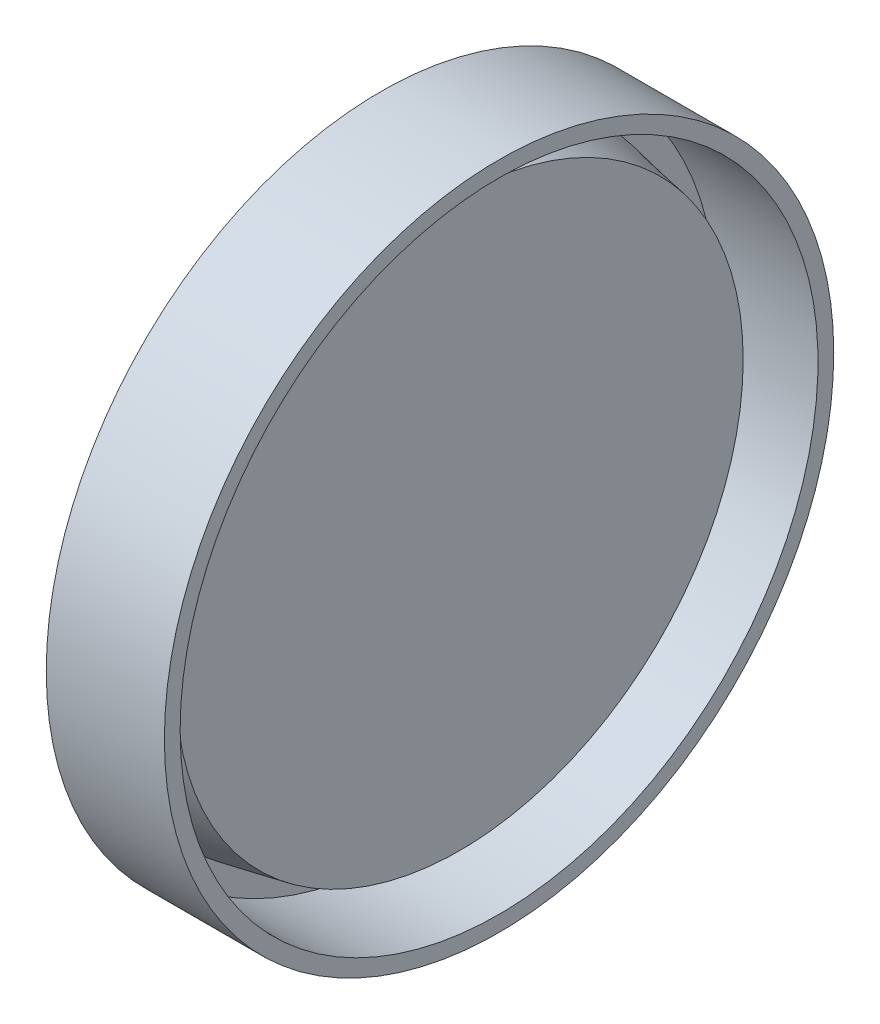
from build123d import *


with BuildPart() as part:
    # Sketch1 → Revolve1 (revolve)
    with BuildSketch(Plane.XY, mode=Mode.PRIVATE) as revolve1_sk:
        Polygon((0, 0), (0, 34.340147425), (-8, 35.840147425), (-8, 42.5), (7, 42.5), (7, 40.5), (-6, 40.5), (-6, 37.5), (2, 36), (2, 0), align=None)
    revolve(revolve1_sk.sketch.rotate(Axis((0, 0, 0), (1, 0, 0)), 90), axis=Axis((0, 0, 0), (1, 0, 0)))


solid = part.part
